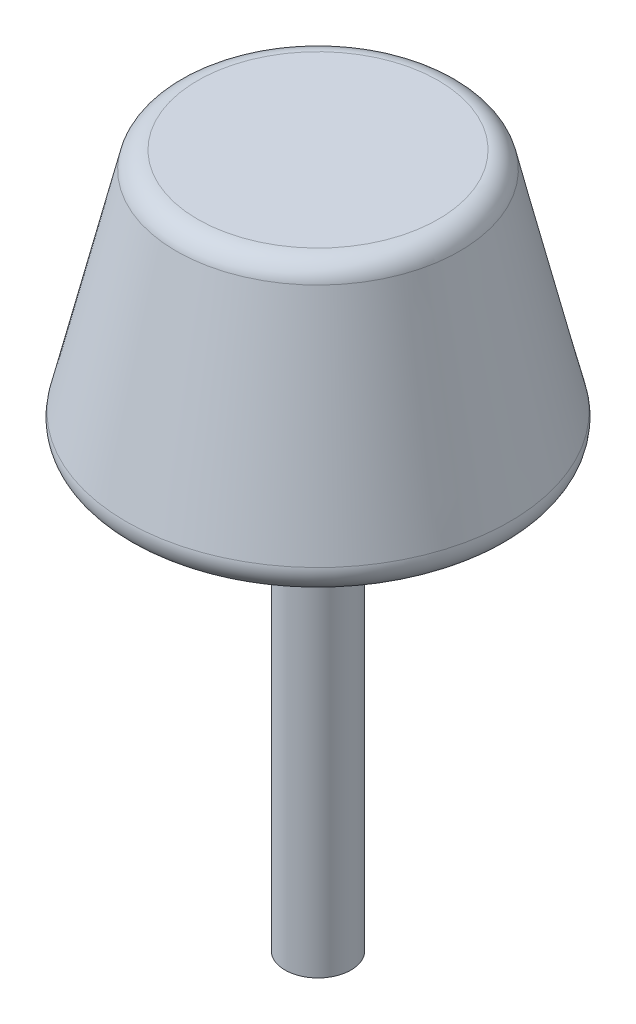
from build123d import *

# Parameters (mm, degrees)
FILLET_1_R = 2


with BuildPart() as part:
    # 草图2 → 旋转1 (revolve)
    with BuildSketch(Plane.XY, mode=Mode.PRIVATE) as revolve_1_sk:
        Polygon((3, 0), (18, 0), (12.5, 23), (0, 23), (0, 0), (0, -40), (3, -40), align=None)
    revolve(revolve_1_sk.sketch.rotate(Axis((0, 0, 0), (0, 1, 0)), 90), axis=Axis((0, 0, 0), (0, 1, 0)))

    # 圆角1
    fillet_1_edges = [part.edges().sort_by_distance(p)[0] for p in [
        (0, 0, 18),
        (0, 23, 12.5),
    ]]
    fillet(fillet_1_edges, radius=FILLET_1_R)


solid = part.part
